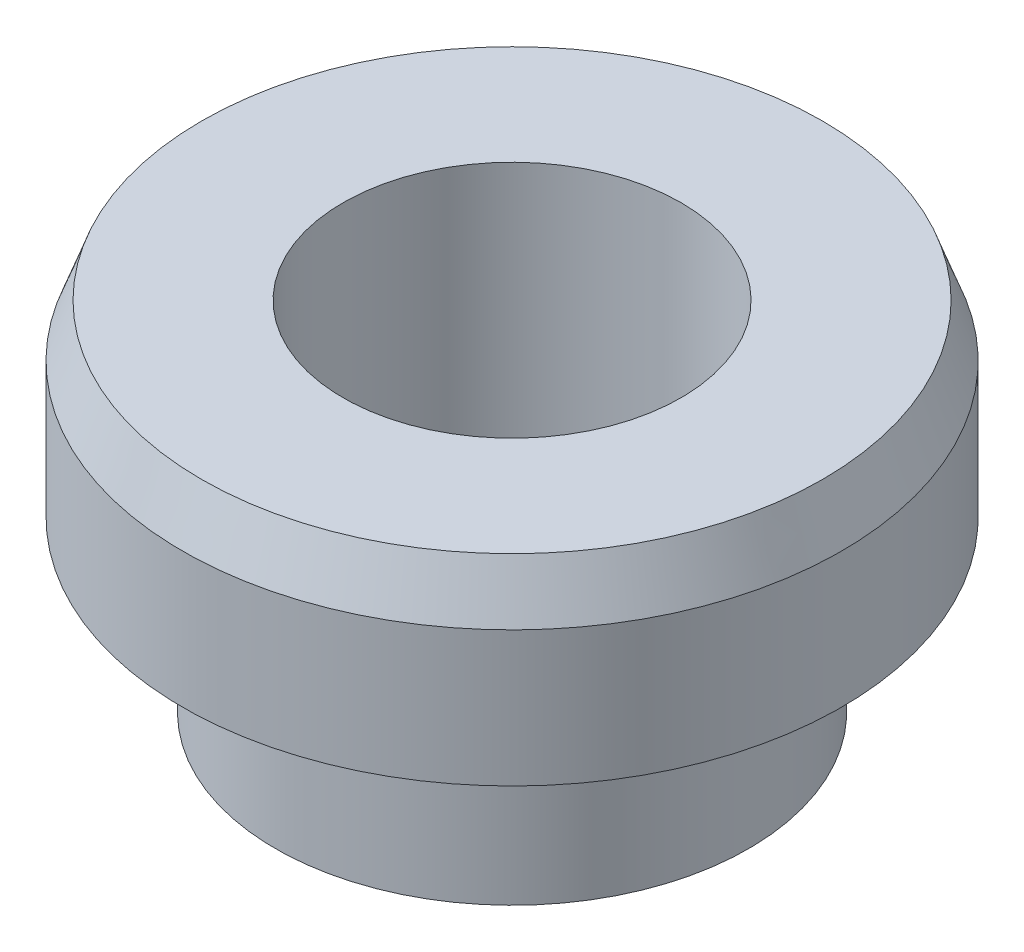
from build123d import *


with BuildPart() as part:
    # Sketch1 → Revolve1 (revolve)
    with BuildSketch(Plane.XY, mode=Mode.PRIVATE) as revolve1_sk:
        Polygon((9.75, 8.909211316), (9.75, 4.909211316), (7, 4.909211316), (7, -0.090788684), (5, -0.090788684), (5, 10.461781218), (9.184910769, 10.461781218), align=None)
    revolve(revolve1_sk.sketch.rotate(Axis((0, 0, 0), (0, 1, 0)), 90), axis=Axis((0, 0, 0), (0, 1, 0)))


solid = part.part
